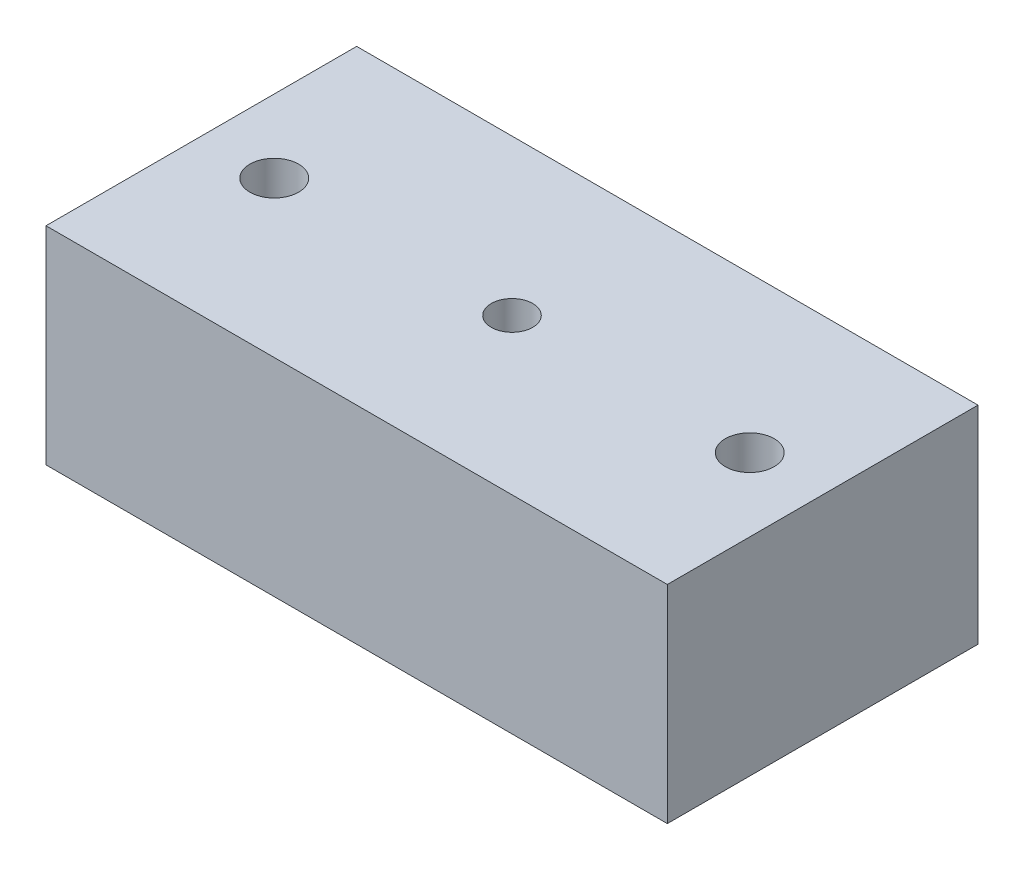
from build123d import *

# Parameters (mm, degrees)
SKETCH1_W           = 120
SKETCH1_H           = 60
SKETCH1_R           = 4
SKETCH1_R_2         = 4.705587352
BOSS_EXTRUDE1_DEPTH = 40


with BuildPart() as part:
    # Sketch1 → Boss-Extrude1 (new body)
    with BuildSketch(Plane(origin=(0, 0, 0), x_dir=(1, 0, 0), z_dir=(0, 1, 0))):
        Rectangle(SKETCH1_W, SKETCH1_H)
        with Locations(Location((0, 0, 0), (0, 0, 270))):
            Circle(SKETCH1_R, mode=Mode.SUBTRACT)
        with Locations(Location((-45.917812161, 0, 0), (0, 0, 270))):
            Circle(SKETCH1_R_2, mode=Mode.SUBTRACT)
        with Locations(Location((45.917812161, 0, 0), (0, 0, 90))):
            Circle(SKETCH1_R_2, mode=Mode.SUBTRACT)
    extrude(amount=BOSS_EXTRUDE1_DEPTH)


solid = part.part
